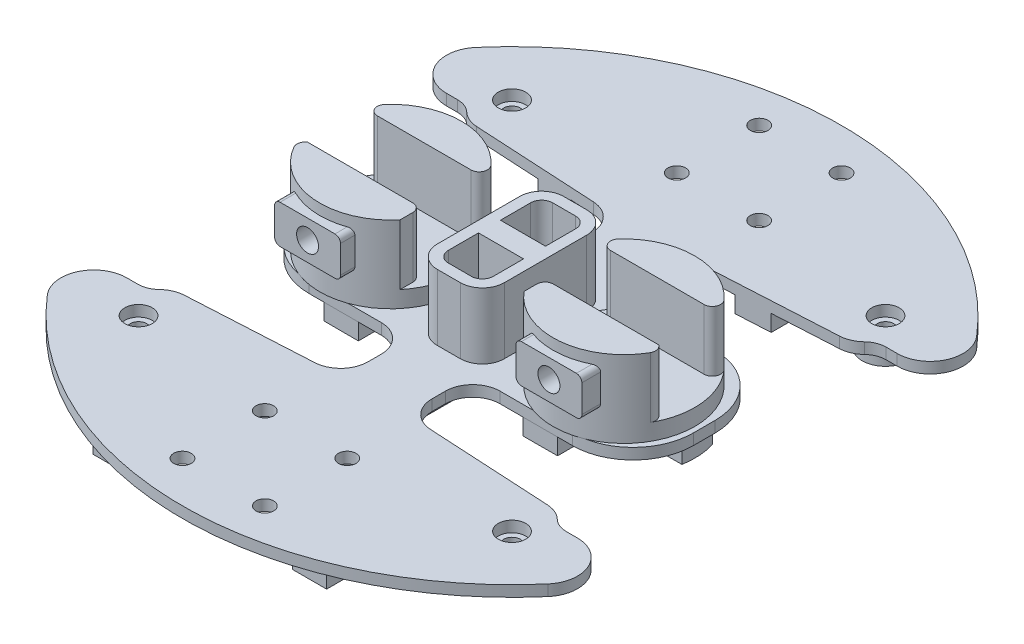
from build123d import *

# Parameters (mm, degrees)
SKETCH_1_R          = 1.5
EXTRUDE_1_DEPTH     = 2
EXTRUDE_2_DEPTH     = 14
EXTRUDE_3_DEPTH     = 3
EXTRUDE_4_DEPTH     = 12
EXTRUDE_START       = -5
SKETCH_5_R          = 1.5
EXTRUDE_5_DEPTH     = 5
SKETCH_6_R          = 2.5
CUT_EXTRUDE_1_DEPTH = 2
SKETCH_7_R          = 1.6
CUT_EXTRUDE_2_DEPTH = 78.513516567
SKETCH_8_R          = 4.001013861
SKETCH_8_R_2        = 4
CUT_EXTRUDE_3_DEPTH = 3
CUT_EXTRUDE_START   = -12
CUT_EXTRUDE_4_DEPTH = 12
EXTRUDE_6_DEPTH     = 3
EXTRUDE_7_DEPTH     = 10
SKETCH_14_R         = 2
CUT_EXTRUDE_5_DEPTH = 12


with BuildPart() as part:
    # 草图1 → 凸台-拉伸1 (new body)
    with BuildSketch(Plane(origin=(0, 0, 0), x_dir=(1, 0, 0), z_dir=(0, 1, 0))):
        with BuildLine():
            Line((-39, -29.101020514), (-41.035574309, -29.101020514))
            ThreePointArc((-41.035574309, -29.101020514), (-46.485376156, -32.5911082), (-45.595082565, -39.001133905))
            ThreePointArc((-45.595082565, -39.001133905), (0, -60), (45.595082565, -39.001133905))
            ThreePointArc((45.595082565, -39.001133905), (46.485376156, -32.5911082), (41.035574309, -29.101020514))
            Line((41.035574309, -29.101020514), (39, -29.101020514))
            ThreePointArc((39, -29.101020514), (36.171572875, -27.929447639), (35, -25.101020514))
            Line((35, -25.101020514), (35, 25.101020514))
            ThreePointArc((35, 25.101020514), (36.171572875, 27.929447639), (39, 29.101020514))
            Line((39, 29.101020514), (41.035574309, 29.101020514))
            ThreePointArc((41.035574309, 29.101020514), (46.485376156, 32.5911082), (45.595082565, 39.001133905))
            ThreePointArc((45.595082565, 39.001133905), (0, 60), (-45.595082565, 39.001133905))
            ThreePointArc((-45.595082565, 39.001133905), (-46.485376156, 32.5911082), (-41.035574309, 29.101020514))
            Line((-41.035574309, 29.101020514), (-39, 29.101020514))
            ThreePointArc((-39, 29.101020514), (-36.171572875, 27.929447639), (-35, 25.101020514))
            Line((-35, 25.101020514), (-35, -25.101020514))
            ThreePointArc((-35, -25.101020514), (-36.171572875, -27.929447639), (-39, -29.101020514))
        make_face()
        with Locations(Location((-34, 34, 0), (0, 0, 270))):
            Circle(SKETCH_1_R, mode=Mode.SUBTRACT)
        with Locations(Location((-34, -34, 0), (0, 0, 270))):
            Circle(SKETCH_1_R, mode=Mode.SUBTRACT)
        with Locations(Location((34, -34, 0), (0, 0, 270))):
            Circle(SKETCH_1_R, mode=Mode.SUBTRACT)
        with Locations(Location((34, 34, 0), (0, 0, 270))):
            Circle(SKETCH_1_R, mode=Mode.SUBTRACT)
    extrude(amount=EXTRUDE_1_DEPTH)

    # 草图2 → 凸台-拉伸2 (add)
    with BuildSketch(Plane(origin=(0, 2, 0), x_dir=(1, 0, 0), z_dir=(0, 1, 0))):
        with BuildLine():
            Line((-29.760298765, 5.25), (-17.433689185, 5.25))
            Line((-17.433689185, 5.25), (-12.721970147, 5.25))
            ThreePointArc((-12.721970147, 5.25), (-11.353263243, 6.13628882), (-11.601982509, 7.74781145))
            ThreePointArc((-11.601982509, 7.74781145), (-21.241134456, 12.069887491), (-30.880286403, 7.74781145))
            ThreePointArc((-30.880286403, 7.74781145), (-31.129005668, 6.13628882), (-29.760298765, 5.25))
        make_face()
        with BuildLine():
            ThreePointArc((-31.982698931, -5.25), (-32.609442109, -6.153101258), (-32.452080089, -7.241051664))
            ThreePointArc((-32.452080089, -7.241051664), (-22.356876736, -13.70124925), (-11.3, -9.076018399))
            Line((-11.3, -9.076018399), (-11.3, -6.75))
            ThreePointArc((-11.3, -6.75), (-11.739339828, -5.689339828), (-12.8, -5.25))
            Line((-12.8, -5.25), (-17.433689185, -5.25))
            Line((-17.433689185, -5.25), (-31.982698931, -5.25))
        make_face()
        with BuildLine():
            ThreePointArc((30.851235281, 7.74781145), (21.212083333, 12.069887491), (11.572931386, 7.74781145))
            ThreePointArc((11.572931386, 7.74781145), (11.324212121, 6.13628882), (12.692919024, 5.25))
            Line((12.692919024, 5.25), (17.404638063, 5.25))
            Line((17.404638063, 5.25), (29.731247642, 5.25))
            ThreePointArc((29.731247642, 5.25), (31.099954546, 6.13628882), (30.851235281, 7.74781145))
        make_face()
        with BuildLine():
            Line((17.404638063, -5.25), (12.770948877, -5.25))
            ThreePointArc((12.770948877, -5.25), (11.710288706, -5.689339828), (11.270948877, -6.75))
            Line((11.270948877, -6.75), (11.270948877, -9.076018399))
            ThreePointArc((11.270948877, -9.076018399), (22.327825613, -13.70124925), (32.423028966, -7.241051664))
            ThreePointArc((32.423028966, -7.241051664), (32.580390987, -6.153101258), (31.953647808, -5.25))
            Line((31.953647808, -5.25), (17.404638063, -5.25))
        make_face()
    extrude(amount=EXTRUDE_2_DEPTH)

    # 草图3 → 凸台-拉伸3 (add)
    with BuildSketch(Plane(origin=(0, 2, 0), x_dir=(1, 0, 0), z_dir=(0, 1, 0))):
        with BuildLine():
            Line((-12.721970147, 5.25), (-17.433689185, 5.25))
            Line((-17.433689185, 5.25), (-29.760298765, 5.25))
            ThreePointArc((-29.760298765, 5.25), (-31.129005668, 6.13628882), (-30.880286403, 7.74781145))
            ThreePointArc((-30.880286403, 7.74781145), (-34.08045479, 0.506550313), (-32.452080089, -7.241051664))
            ThreePointArc((-32.452080089, -7.241051664), (-32.609442109, -6.153101258), (-31.982698931, -5.25))
            Line((-31.982698931, -5.25), (-17.433689185, -5.25))
            Line((-17.433689185, -5.25), (-12.8, -5.25))
            ThreePointArc((-12.8, -5.25), (-11.739339828, -5.689339828), (-11.3, -6.75))
            Line((-11.3, -6.75), (-11.3, -9.076018399))
            ThreePointArc((-11.3, -9.076018399), (-9.096214363, -5.217254192), (-8.331413467, -0.839833497))
            ThreePointArc((-8.331413467, -0.839833497), (-9.176731068, 3.754844609), (-11.601982509, 7.74781145))
            ThreePointArc((-11.601982509, 7.74781145), (-11.353263243, 6.13628882), (-12.721970147, 5.25))
        make_face()
        with BuildLine():
            ThreePointArc((11.270948877, -6.75), (11.710288706, -5.689339828), (12.770948877, -5.25))
            Line((12.770948877, -5.25), (17.404638063, -5.25))
            Line((17.404638063, -5.25), (31.953647808, -5.25))
            ThreePointArc((31.953647808, -5.25), (32.580390987, -6.153101258), (32.423028966, -7.241051664))
            ThreePointArc((32.423028966, -7.241051664), (33.689885146, -4.151231681), (34.121804322, -0.839833497))
            ThreePointArc((34.121804322, -0.839833497), (33.276486721, 3.754844609), (30.851235281, 7.74781145))
            ThreePointArc((30.851235281, 7.74781145), (31.099954546, 6.13628882), (29.731247642, 5.25))
            Line((29.731247642, 5.25), (17.404638063, 5.25))
            Line((17.404638063, 5.25), (12.692919024, 5.25))
            ThreePointArc((12.692919024, 5.25), (11.324212121, 6.13628882), (11.572931386, 7.74781145))
            ThreePointArc((11.572931386, 7.74781145), (8.304441542, -0.608145345), (11.270948877, -9.076018399))
            Line((11.270948877, -9.076018399), (11.270948877, -6.75))
        make_face()
    extrude(amount=EXTRUDE_3_DEPTH)

    # 草图4 → 凸台-拉伸4 (add)
    with BuildSketch(Plane(origin=(0, 2, 0), x_dir=(1, 0, 0), z_dir=(0, 1, 0))):
        with BuildLine():
            Line((-2.1, -11.5), (2.1, -11.5))
            ThreePointArc((2.1, -11.5), (4.928427125, -10.328427125), (6.1, -7.5))
            Line((6.1, -7.5), (6.1, 7.5))
            ThreePointArc((6.1, 7.5), (4.928427125, 10.328427125), (2.1, 11.5))
            Line((2.1, 11.5), (-2.1, 11.5))
            ThreePointArc((-2.1, 11.5), (-4.928427125, 10.328427125), (-6.1, 7.5))
            Line((-6.1, 7.5), (-6.1, -7.5))
            ThreePointArc((-6.1, -7.5), (-4.928427125, -10.328427125), (-2.1, -11.5))
        make_face()
        with BuildLine():
            Line((-2.1, -9.5), (2.1, -9.5))
            ThreePointArc((2.1, -9.5), (3.514213562, -8.914213562), (4.1, -7.5))
            Line((4.1, -7.5), (4.1, -1.999947251))
            Line((4.1, -1.999947251), (-0.014525561, -1.999947251))
            Line((-0.014525561, -1.999947251), (-4.1, -1.999947251))
            Line((-4.1, -1.999947251), (-4.1, -7.5))
            ThreePointArc((-4.1, -7.5), (-3.514213562, -8.914213562), (-2.1, -9.5))
        make_face(mode=Mode.SUBTRACT)
        with BuildLine():
            Line((-2.1, 9.5), (2.1, 9.5))
            ThreePointArc((2.1, 9.5), (3.514213562, 8.914213562), (4.1, 7.5))
            Line((4.1, 7.5), (4.1, 1.999947251))
            Line((4.1, 1.999947251), (-0.014525561, 1.999947251))
            Line((-0.014525561, 1.999947251), (-4.1, 1.999947251))
            Line((-4.1, 1.999947251), (-4.1, 7.5))
            ThreePointArc((-4.1, 7.5), (-3.514213562, 8.914213562), (-2.1, 9.5))
        make_face(mode=Mode.SUBTRACT)
    extrude(amount=EXTRUDE_4_DEPTH)

    # 草图5 → 凸台-拉伸5 (add)
    with BuildSketch(Plane(origin=(0, 2, 0), x_dir=(1, 0, 0), z_dir=(0, 1, 0)).offset(EXTRUDE_START)):
        with BuildLine():
            ThreePointArc((-33.566578656, 3), (-34.121938835, 0.023748895), (-33.968843468, -3))
            Line((-33.968843468, -3), (-3, -3))
            Line((-3, -3), (-3, -31))
            Line((-3, -31), (-31, -31))
            ThreePointArc((-31, -31), (-38.242640687, -34), (-31, -37))
            Line((-31, -37), (-3, -37))
            Line((-3, -37), (-3, -55))
            Line((-3, -55), (3, -55))
            Line((3, -55), (3, -37))
            Line((3, -37), (31, -37))
            ThreePointArc((31, -37), (38.242640687, -34), (31, -31))
            Line((31, -31), (3, -31))
            Line((3, -31), (3, -3))
            Line((3, -3), (33.939792345, -3))
            ThreePointArc((33.939792345, -3), (34.092887713, 0.023748895), (33.537527533, 3))
            Line((33.537527533, 3), (3, 3))
            Line((3, 3), (3, 31))
            Line((3, 31), (31, 31))
            ThreePointArc((31, 31), (38.242640687, 34), (31, 37))
            Line((31, 37), (3, 37))
            Line((3, 37), (3, 55))
            Line((3, 55), (-3, 55))
            Line((-3, 55), (-3, 37))
            Line((-3, 37), (-31, 37))
            ThreePointArc((-31, 37), (-38.242640687, 34), (-31, 31))
            Line((-31, 31), (-3, 31))
            Line((-3, 31), (-3, 3))
            Line((-3, 3), (-33.566578656, 3))
        make_face()
        with Locations((-34, -34)):
            Circle(SKETCH_5_R, mode=Mode.SUBTRACT)
        with Locations((34, -34)):
            Circle(SKETCH_5_R, mode=Mode.SUBTRACT)
        with Locations((-34, 34)):
            Circle(SKETCH_5_R, mode=Mode.SUBTRACT)
        with Locations((34, 34)):
            Circle(SKETCH_5_R, mode=Mode.SUBTRACT)
    extrude(amount=EXTRUDE_5_DEPTH)

    # 草图6 → 切除-拉伸1 (cut)
    with BuildSketch(Plane(origin=(0, 2, 0), x_dir=(1, 0, 0), z_dir=(0, 1, 0))):
        with Locations(Location((-34, 34, 0), (0, 0, 270))):
            Circle(SKETCH_6_R)
        with Locations(Location((34, 34, 0), (0, 0, 270))):
            Circle(SKETCH_6_R)
        with Locations(Location((34, -34, 0), (0, 0, 270))):
            Circle(SKETCH_6_R)
        with Locations(Location((-34, -34, 0), (0, 0, 270))):
            Circle(SKETCH_6_R)
    extrude(amount=-CUT_EXTRUDE_1_DEPTH, mode=Mode.SUBTRACT)

    # 草图7 → 切除-拉伸2 (cut, through all)
    with BuildSketch(Plane(origin=(0, 2, 0), x_dir=(1, 0, 0), z_dir=(0, 1, 0))):
        with Locations(Location((7.5, 52.5, 0), (0, 0, 270))):
            Circle(SKETCH_7_R)
        with Locations(Location((7.5, 37.5, 0), (0, 0, 270))):
            Circle(SKETCH_7_R)
        with Locations(Location((-7.5, 37.5, 0), (0, 0, 270))):
            Circle(SKETCH_7_R)
        with Locations(Location((-7.5, 52.5, 0), (0, 0, 270))):
            Circle(SKETCH_7_R)
        with Locations(Location((-7.5, -52.5, 0), (0, 0, 270))):
            Circle(SKETCH_7_R)
        with Locations(Location((-7.5, -37.5, 0), (0, 0, 161.790043136))):
            Circle(SKETCH_7_R)
        with Locations(Location((7.5, -37.5, 0), (0, 0, 18.209956864))):
            Circle(SKETCH_7_R)
        with Locations(Location((7.5, -52.5, 0), (0, 0, 270))):
            Circle(SKETCH_7_R)
    extrude(amount=-CUT_EXTRUDE_2_DEPTH, mode=Mode.SUBTRACT)

    # 草图8 → 切除-拉伸3 (cut)
    with BuildSketch(Plane.XZ.offset(3)):
        with Locations((-7.5, 37.5)):
            Circle(SKETCH_8_R)
        with Locations((7.5, 37.5)):
            Circle(SKETCH_8_R_2)
        with Locations((-7.5, -37.5)):
            Circle(SKETCH_8_R_2)
        with Locations((7.5, -37.5)):
            Circle(SKETCH_8_R_2)
    extrude(amount=-CUT_EXTRUDE_3_DEPTH, mode=Mode.SUBTRACT)

    # 草图9 → 切除-拉伸4 (cut)
    with BuildSketch(Plane(origin=(0, 2, 0), x_dir=(1, 0, 0), z_dir=(0, 1, 0)).offset(CUT_EXTRUDE_START)):
        with BuildLine():
            Line((-10.535842228, 25.360604566), (-33.053360299, 26.603550329))
            ThreePointArc((-33.053360299, 26.603550329), (-34.764682347, 27.009236792), (-36.228049853, 27.98481877))
            ThreePointArc((-36.228049853, 27.98481877), (-37.505877017, 28.811491713), (-39, 29.101020514))
            Line((-39, 29.101020514), (-48.259432188, 29.101020514))
            Line((-48.259432188, 29.101020514), (-35, 1.987551599))
            ThreePointArc((-35, 1.987551599), (-31.778174593, 9.765726192), (-24, 12.987551599))
            Line((-24, 12.987551599), (-10.810150241, 12.987551599))
            ThreePointArc((-10.810150241, 12.987551599), (-7.290881224, 14.445280556), (-5.833152267, 17.964549573))
            Line((-5.833152267, 17.964549573), (-5.833152267, 20.391171605))
            ThreePointArc((-5.833152267, 20.391171605), (-7.195199394, 23.812083648), (-10.535842228, 25.360604566))
        make_face()
        with BuildLine():
            Line((-39, -29.101020514), (-48.259432188, -29.101020514))
            Line((-48.259432188, -29.101020514), (-35, -1.987551599))
            ThreePointArc((-35, -1.987551599), (-31.778174593, -9.765726192), (-24, -12.987551599))
            Line((-24, -12.987551599), (-10.810150241, -12.987551599))
            ThreePointArc((-10.810150241, -12.987551599), (-7.290881224, -14.445280556), (-5.833152267, -17.964549573))
            Line((-5.833152267, -17.964549573), (-5.833152267, -20.391171605))
            ThreePointArc((-5.833152267, -20.391171605), (-7.195199394, -23.812083648), (-10.535842228, -25.360604566))
            Line((-10.535842228, -25.360604566), (-33.053360299, -26.603550329))
            ThreePointArc((-33.053360299, -26.603550329), (-34.764682347, -27.009236792), (-36.228049853, -27.98481877))
            ThreePointArc((-36.228049853, -27.98481877), (-37.505877017, -28.811491713), (-39, -29.101020514))
        make_face()
        with BuildLine():
            Line((10.535842228, -25.360604566), (33.053360299, -26.603550329))
            ThreePointArc((33.053360299, -26.603550329), (34.764682347, -27.009236792), (36.228049853, -27.98481877))
            ThreePointArc((36.228049853, -27.98481877), (37.505877017, -28.811491713), (39, -29.101020514))
            Line((39, -29.101020514), (48.259432188, -29.101020514))
            Line((48.259432188, -29.101020514), (35, -1.987551599))
            ThreePointArc((35, -1.987551599), (31.778174593, -9.765726192), (24, -12.987551599))
            Line((24, -12.987551599), (10.810150241, -12.987551599))
            ThreePointArc((10.810150241, -12.987551599), (7.290881224, -14.445280556), (5.833152267, -17.964549573))
            Line((5.833152267, -17.964549573), (5.833152267, -20.391171605))
            ThreePointArc((5.833152267, -20.391171605), (7.195199394, -23.812083648), (10.535842228, -25.360604566))
        make_face()
        with BuildLine():
            Line((39, 29.101020514), (48.259432188, 29.101020514))
            Line((48.259432188, 29.101020514), (35, 1.987551599))
            ThreePointArc((35, 1.987551599), (31.778174593, 9.765726192), (24, 12.987551599))
            Line((24, 12.987551599), (10.810150241, 12.987551599))
            ThreePointArc((10.810150241, 12.987551599), (7.290881224, 14.445280556), (5.833152267, 17.964549573))
            Line((5.833152267, 17.964549573), (5.833152267, 20.391171605))
            ThreePointArc((5.833152267, 20.391171605), (7.195199394, 23.812083648), (10.535842228, 25.360604566))
            Line((10.535842228, 25.360604566), (33.053360299, 26.603550329))
            ThreePointArc((33.053360299, 26.603550329), (34.764682347, 27.009236792), (36.228049853, 27.98481877))
            ThreePointArc((36.228049853, 27.98481877), (37.505877017, 28.811491713), (39, 29.101020514))
        make_face()
    extrude(amount=CUT_EXTRUDE_4_DEPTH, mode=Mode.SUBTRACT)

    # 草图10 → 凸台-拉伸6 (add)
    with BuildSketch(Plane.XZ.offset(3)):
        Polygon((-21.249509377, 12.950430124), (-21.249509377, -12.987551599), (-15, -12.987551599), (-15, 12.978258627), align=None)
        Polygon((-21.249509377, 25.951988889), (-15, 25.607021865), (-15, 55), (-21.249509377, 55), align=None)
        Polygon((-15, -55), (-21.249509377, -55), (-21.249509377, -25.951988889), (-15, -25.607021865), align=None)
        Polygon((21.249509377, -25.951988889), (21.249509377, -55), (15, -55), (15, -25.607021865), align=None)
        Polygon((15, 12.978258627), (15, -12.987551599), (21.249509377, -12.987551599), (21.249509377, 12.950430124), align=None)
        Polygon((21.249509377, 55), (21.249509377, 25.951988889), (15, 25.607021865), (15, 55), align=None)
    extrude(amount=-EXTRUDE_6_DEPTH)

    # 草图12 → 凸台-拉伸7 (add)
    with BuildSketch(Plane(origin=(0, 0, 5.25), x_dir=(-1, 0, 0), z_dir=(0, 0, -1))):
        with BuildLine():
            ThreePointArc((-26.974731683, 7.025), (-27.681838464, 7.317893219), (-27.974731683, 8.025))
            Line((-27.974731683, 8.025), (-27.974731683, 13.025))
            ThreePointArc((-27.974731683, 13.025), (-27.681838464, 13.732106781), (-26.974731683, 14.025))
            Line((-26.974731683, 14.025), (-16.974731683, 14.025))
            ThreePointArc((-16.974731683, 14.025), (-16.267624902, 13.732106781), (-15.974731683, 13.025))
            Line((-15.974731683, 13.025), (-15.974731683, 8.025))
            ThreePointArc((-15.974731683, 8.025), (-16.267624902, 7.317893219), (-16.974731683, 7.025))
            Line((-16.974731683, 7.025), (-26.974731683, 7.025))
        make_face()
        with BuildLine():
            Line((26.974731683, 14.025), (21.974731683, 14.025))
            Line((21.974731683, 14.025), (21.974731683, 7.025))
            Line((21.974731683, 7.025), (26.974731683, 7.025))
            ThreePointArc((26.974731683, 7.025), (27.681838464, 7.317893219), (27.974731683, 8.025))
            Line((27.974731683, 8.025), (27.974731683, 13.025))
            ThreePointArc((27.974731683, 13.025), (27.681838464, 13.732106781), (26.974731683, 14.025))
        make_face()
        with BuildLine():
            Line((21.974731683, 7.025), (21.974731683, 14.025))
            Line((21.974731683, 14.025), (16.974731683, 14.025))
            ThreePointArc((16.974731683, 14.025), (16.267624902, 13.732106781), (15.974731683, 13.025))
            Line((15.974731683, 13.025), (15.974731683, 8.025))
            ThreePointArc((15.974731683, 8.025), (16.267624902, 7.317893219), (16.974731683, 7.025))
            Line((16.974731683, 7.025), (21.974731683, 7.025))
        make_face()
    extrude(amount=-EXTRUDE_7_DEPTH)

    # 草图14 → 切除-拉伸5 (cut)
    with BuildSketch(Plane(origin=(0, 0, 5.25), x_dir=(-1, 0, 0), z_dir=(0, 0, -1))):
        with Locations((-21.974731683, 10.525)):
            Circle(SKETCH_14_R)
        with Locations((21.974731683, 10.525)):
            Circle(SKETCH_14_R)
    extrude(amount=-CUT_EXTRUDE_5_DEPTH, mode=Mode.SUBTRACT)


solid = part.part
